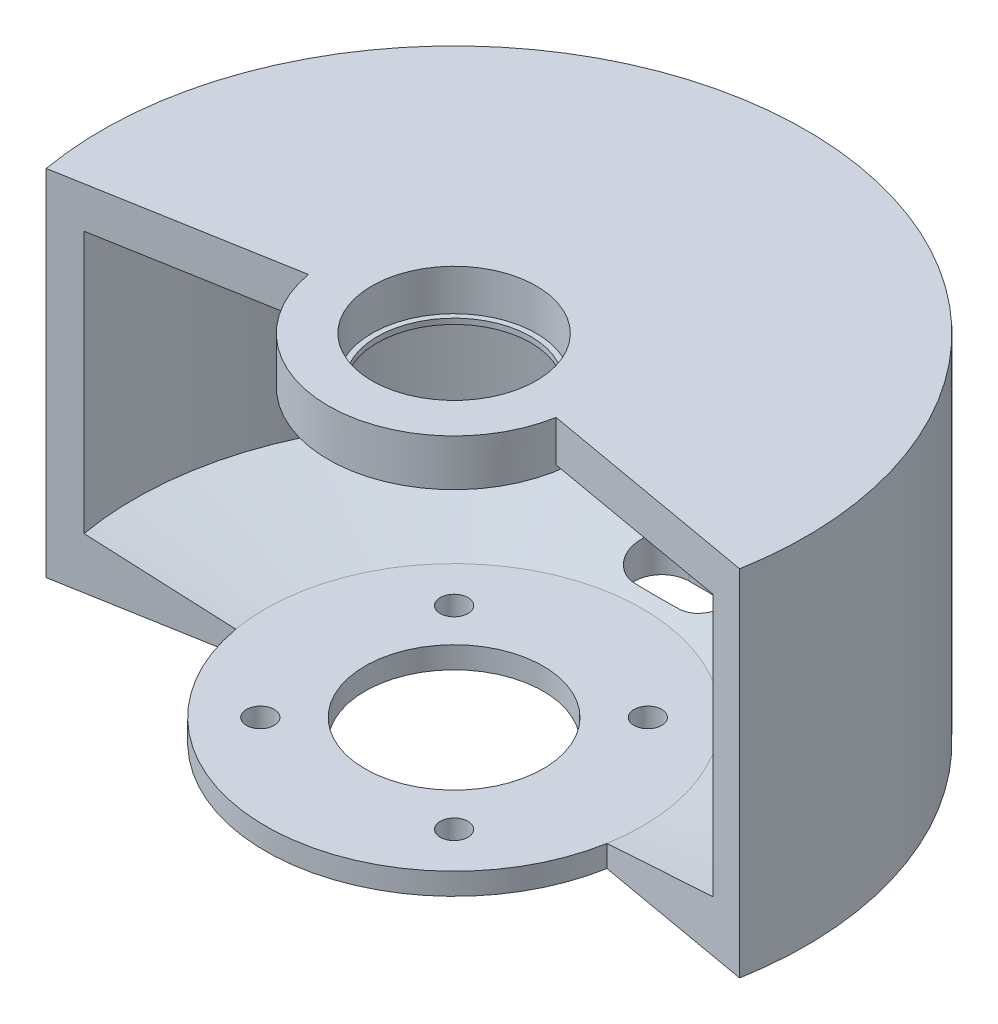
from build123d import *

# Parameters (mm, degrees)
BOSS_EXTRUDE1_START = -14.125
SKETCH2_R           = 27.5
SKETCH2_R_2         = 13.000000035
SKETCH2_R_3         = 2.025
BOSS_EXTRUDE1_DEPTH = 3.175
BOSS_EXTRUDE2_START = 28.4275
SKETCH3_R           = 18.35
SKETCH3_R_2         = 12
BOSS_EXTRUDE2_DEPTH = 6
REVOLVE1_ANGLE      = 200
BOSS_EXTRUDE3_START = 0.79375
SKETCH5_R           = 18.35
SKETCH5_R_2         = 11.20625
BOSS_EXTRUDE3_DEPTH = 0.79375
CUT_EXTRUDE1_REACH  = 91.201


with BuildPart() as part:
    # Sketch2 → Boss-Extrude1 (new body)
    with BuildSketch(Plane(origin=(0, 0, 0), x_dir=(1, 0, 0), z_dir=(0, 1, 0)).offset(BOSS_EXTRUDE1_START)):
        with Locations(Location((0, 0, 0), (0, 0, 270))):
            Circle(SKETCH2_R)
        with Locations(Location((0, 0, 0), (0, 0, 270))):
            Circle(SKETCH2_R_2, mode=Mode.SUBTRACT)
        with Locations(Location((-14.142135624, -14.142135624, 0), (0, 0, 270))):
            Circle(SKETCH2_R_3, mode=Mode.SUBTRACT)
        with Locations(Location((14.142135624, -14.142135624, 0), (0, 0, 270))):
            Circle(SKETCH2_R_3, mode=Mode.SUBTRACT)
        with Locations(Location((14.142135624, 14.142135624, 0), (0, 0, 270))):
            Circle(SKETCH2_R_3, mode=Mode.SUBTRACT)
        with Locations(Location((-14.142135624, 14.142135624, 0), (0, 0, 270))):
            Circle(SKETCH2_R_3, mode=Mode.SUBTRACT)
    extrude(amount=-BOSS_EXTRUDE1_DEPTH)



with BuildPart() as body_2:
    # Sketch3 → Boss-Extrude2 (new body)
    with BuildSketch(Plane(origin=(0, 0, 0), x_dir=(1, 0, 0), z_dir=(0, 1, 0)).offset(BOSS_EXTRUDE2_START)):
        with Locations(Location((0, 0, 0), (0, 0, 270))):
            Circle(SKETCH3_R)
        with Locations(Location((0, 0, 0), (0, 0, 270))):
            Circle(SKETCH3_R_2, mode=Mode.SUBTRACT)
    extrude(amount=BOSS_EXTRUDE2_DEPTH)


with BuildPart() as part_1:
    add(part.part)

    add(body_2.part)  # Revolve1 merges body 2
    # Sketch4 → Revolve1 (revolve, symmetric)
    with BuildSketch(Plane(origin=(0, 0, 0), x_dir=(0, 0, -1), z_dir=(1, 0, 0))) as revolve1_sk:
        Polygon((27.5, -17.3), (51.38625, -17.3), (51.38625, 34.42749997), (18.35, 34.42749997), (18.35, 28.427500017), (46.62375, 28.427500017), (46.62375, -9.795291189), (27.5, -14.125), align=None)
    revolve(axis=Axis((0, -14.125, 0), (0, 1, 0)), revolution_arc=REVOLVE1_ANGLE / 2)
    revolve(revolve1_sk.sketch, axis=Axis((0, -14.125, 0), (0, -1, 0)), revolution_arc=REVOLVE1_ANGLE / 2)

    # Sketch5 → Boss-Extrude3 (add)
    with BuildSketch(Plane.XZ.offset(-28.427500017).offset(BOSS_EXTRUDE3_START)):
        with Locations(Location((0, 0, 0), (0, 0, 270))):
            Circle(SKETCH5_R)
        with Locations(Location((0, 0, 0), (0, 0, 270))):
            Circle(SKETCH5_R_2, mode=Mode.SUBTRACT)
    extrude(amount=-BOSS_EXTRUDE3_DEPTH)

    # Cut-Extrude1: up to this cone (the profile starts outside it)
    cut_extrude1_end = Plane(origin=(0, -17.3, 0), z_dir=(0, 1, 0)).offset(-3.051131024) * Cone(4.417e-06, 478.031284628, 108.228576807, align=(Align.CENTER, Align.CENTER, Align.MIN), mode=Mode.PRIVATE)
    # Sketch6 → Cut-Extrude1 (cut, up to the surface)
    with BuildSketch(Plane(origin=(0, -17.3, 0), x_dir=(-1, 0, 0), z_dir=(0, -1, 0)), mode=Mode.PRIVATE) as cut_extrude1_sk1:
        with BuildLine():
            Line((3.25, 29.61125), (-3.25, 29.61125))
            ThreePointArc((-3.25, 29.61125), (-7.21875, 33.58), (-3.25, 37.54875))
            Line((-3.25, 37.54875), (3.25, 37.54875))
            ThreePointArc((3.25, 37.54875), (7.21875, 33.58), (3.25, 29.61125))
        make_face()
    cut_extrude1_tool1 = extrude(cut_extrude1_sk1.sketch, amount=-CUT_EXTRUDE1_REACH, mode=Mode.PRIVATE) - cut_extrude1_end
    add(cut_extrude1_tool1.solids().sort_by_distance((0, -17.3, -33.58))[0], mode=Mode.SUBTRACT)


solid = part_1.part
